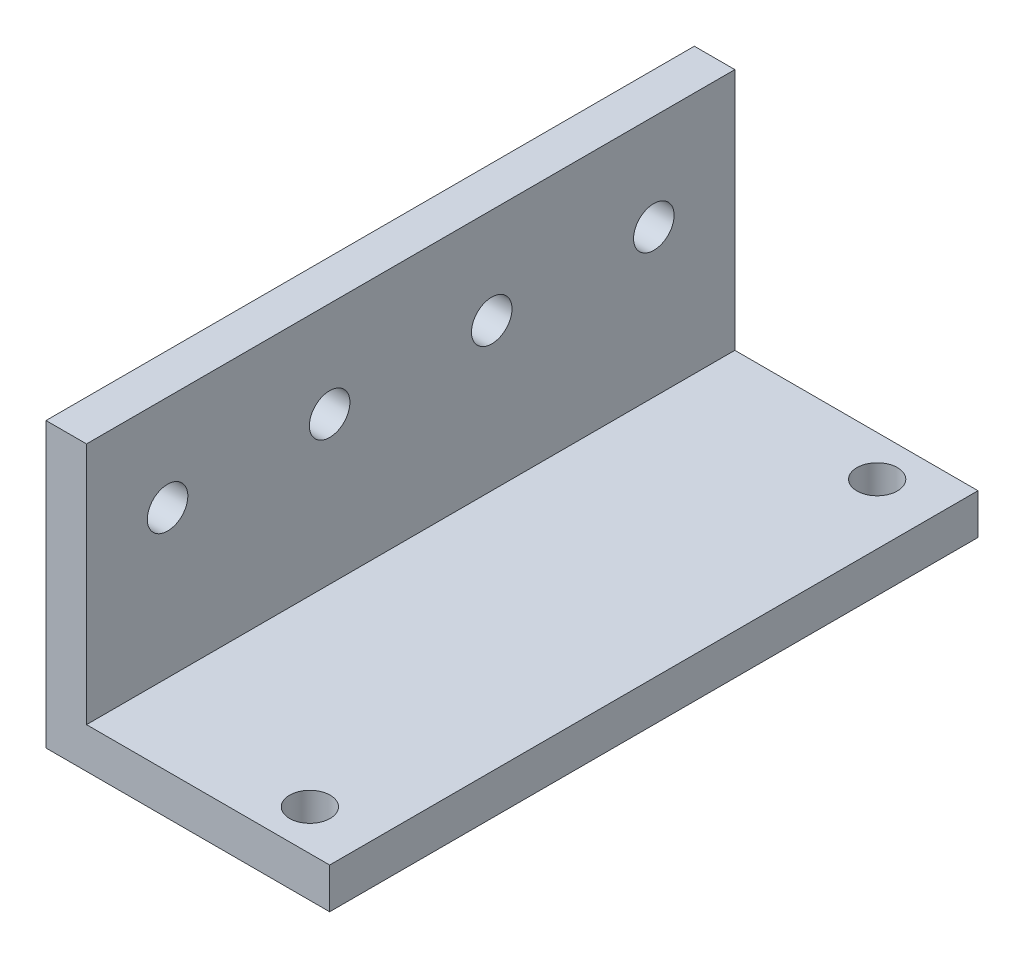
from build123d import *

# Parameters (mm, degrees)
BOSS_EXTRUDE1_DEPTH = 101.6
SKETCH2_R           = 3.175
CUT_EXTRUDE1_DEPTH  = 25.146
SKETCH3_R           = 3.175
CUT_EXTRUDE2_DEPTH  = 25.146


with BuildPart() as part:
    # Sketch1 → Boss-Extrude1 (new body)
    with BuildSketch(Plane.XY):
        Polygon((0, 44.45), (0, 0), (44.45, 0), (44.45, 6.35), (6.35, 6.35), (6.35, 44.45), align=None)
    extrude(amount=BOSS_EXTRUDE1_DEPTH)

    # Sketch2 → Cut-Extrude1 (cut)
    with BuildSketch(Plane(origin=(0, 6.35, 0), x_dir=(1, 0, 0), z_dir=(0, 1, 0))):
        with Locations(Location((35, -95.25, 0), (0, 0, 180))):
            Circle(SKETCH2_R)
        with Locations(Location((35, -6.35, 0), (0, 0, 180))):
            Circle(SKETCH2_R)
    extrude(amount=-CUT_EXTRUDE1_DEPTH, mode=Mode.SUBTRACT)

    # Sketch3 → Cut-Extrude2 (cut)
    with BuildSketch(Plane(origin=(6.35, 0, 0), x_dir=(0, 0, -1), z_dir=(1, 0, 0))):
        with Locations(Location((-12.7, 29.45, 0), (0, 0, 90))):
            Circle(SKETCH3_R)
        with Locations(Location((-63.5, 29.45, 0), (0, 0, 90))):
            Circle(SKETCH3_R)
        with Locations(Location((-88.9, 29.45, 0), (0, 0, 90))):
            Circle(SKETCH3_R)
        with Locations(Location((-38.1, 29.45, 0), (0, 0, 90))):
            Circle(SKETCH3_R)
    extrude(amount=-CUT_EXTRUDE2_DEPTH, mode=Mode.SUBTRACT)


solid = part.part
